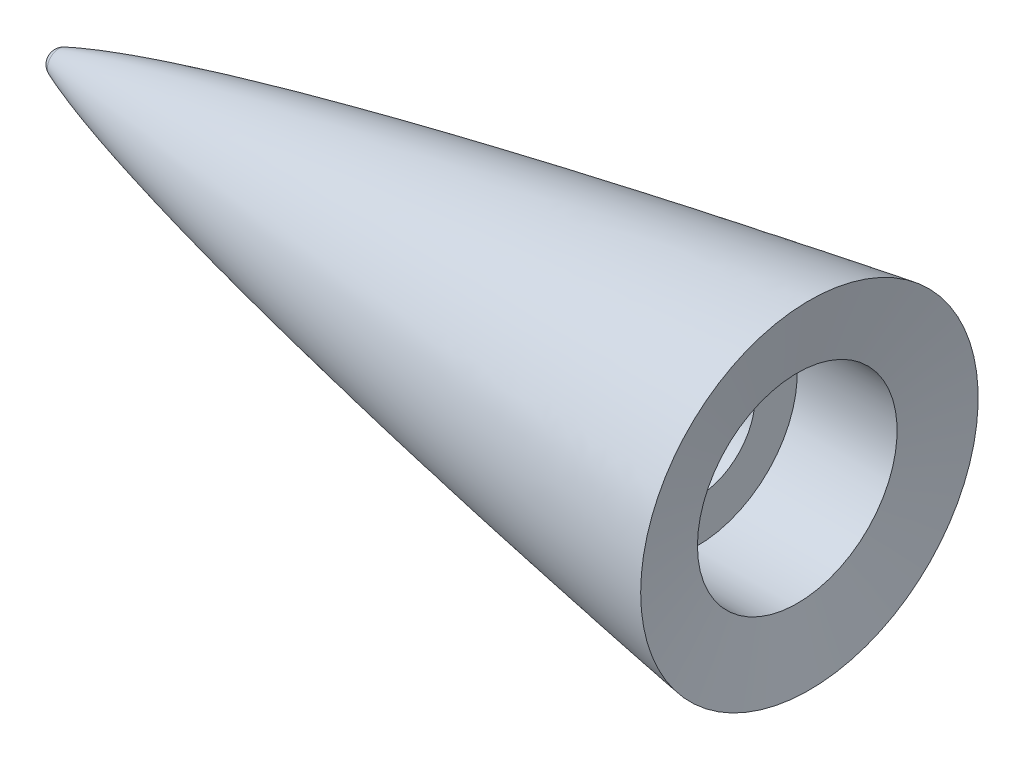
from build123d import *

# Parameters (mm, degrees)
TAPPED_HOLE_FOR_9_16_12_HELICOIL1_D     = 14.68374
TAPPED_HOLE_FOR_9_16_12_HELICOIL1_DEPTH = 27.94
TAPPED_HOLE_FOR_9_16_12_HELICOIL1_TIP   = 4.411440553


with BuildPart() as part:
    # Sketch1 → Revolve2 (revolve)
    with BuildSketch(Plane(origin=(0, 0, 0), x_dir=(1, 0, 0), z_dir=(0, 1, 0)), mode=Mode.PRIVATE) as revolve2_sk:
        with BuildLine():
            Line((1.697321091, 0), (45.819405393, 0))
            Line((45.819405393, 0), (83.919405393, 0))
            Line((83.919405393, 0), (83.919405393, 7.68858))
            Line((83.919405393, 7.68858), (83.919405393, 12.7))
            Line((83.919405393, 12.7), (96.619405393, 12.7))
            Line((96.619405393, 12.7), (98.165428581, 21.4679332))
            add(Edge.make_bspline(
                [(2.682127148, 1.468644362), (2.982092127, 1.591742283), (3.982765764, 1.986976913), (6.075542743, 2.735585346), (9.959285205, 3.961402854), (15.35260807, 5.458934046), (21.847317263, 7.086678944), (29.055363889, 8.749177841), (36.286920774, 10.313744718), (43.531901048, 11.801111844), (50.793776988, 13.226984496), (58.058153921, 14.599266319), (64.433980883, 15.762645369), (69.883896781, 16.732062359), (74.459068804, 17.529825957), (78.065425347, 18.150661812), (81.784961377, 18.781283529), (85.307065103, 19.372441088), (89.168740248, 20.010357493), (92.45838759, 20.54964543), (95.664328261, 21.067043036), (97.333372349, 21.334925019), (98.164963492, 21.467858845), (98.165428581, 21.4679332)],
                knots=[0.027847292, 0.027847292, 0.027847292, 0.027847292, 0.027847292, 0.039565322, 0.06672611, 0.108155752, 0.174993972, 0.2418322, 0.308670423, 0.375508647, 0.442346873, 0.509185099, 0.576023325, 0.642861549, 0.676280662, 0.709699776, 0.743118888, 0.776538001, 0.809957114, 0.843376227, 0.87679534, 0.910214452, 0.910233153, 0.910233153, 0.910233153, 0.910233153, 0.910233153], degree=4))
            ThreePointArc((2.682127148, 1.468644362), (1.966311917, 0.884132234), (1.697321091, 0))
        make_face()
    revolve(revolve2_sk.sketch.rotate(Axis((0, 0, 0), (1, 0, 0)), 180), axis=Axis((0, 0, 0), (1, 0, 0)))

    # Tapped Hole for 9/16-12 Helicoil1
    with Locations(Plane(origin=(83.919405393, 0, 0), x_dir=(0, 0, -1), z_dir=(1, 0, 0))):
        with Locations((0, 0)):
            Hole(TAPPED_HOLE_FOR_9_16_12_HELICOIL1_D / 2, depth=TAPPED_HOLE_FOR_9_16_12_HELICOIL1_DEPTH)
            with Locations((0, 0, -(TAPPED_HOLE_FOR_9_16_12_HELICOIL1_DEPTH + TAPPED_HOLE_FOR_9_16_12_HELICOIL1_TIP / 2))):  # 118° drill point
                Cone(0, TAPPED_HOLE_FOR_9_16_12_HELICOIL1_D / 2, TAPPED_HOLE_FOR_9_16_12_HELICOIL1_TIP, mode=Mode.SUBTRACT)


solid = part.part
